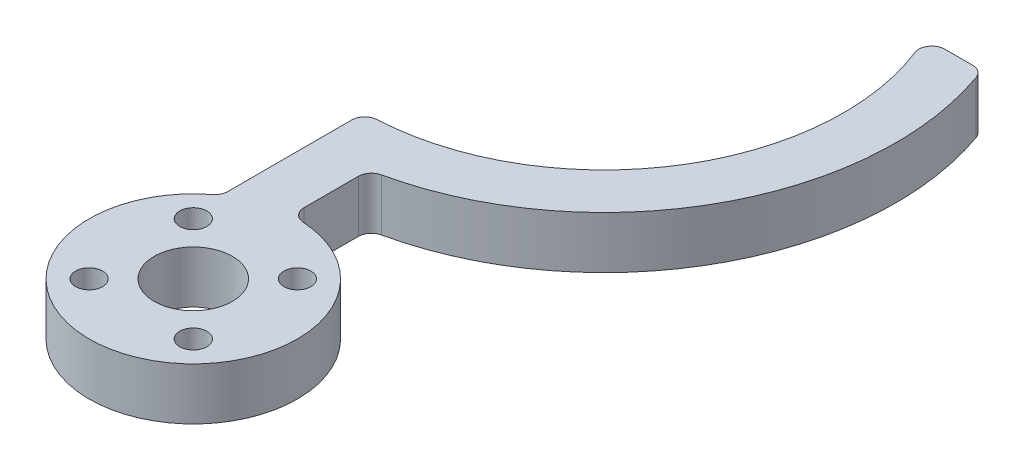
from build123d import *

# Parameters (mm, degrees)
SKETCH1_R           = 2.075
SKETCH1_R_2         = 6.003208263
BOSS_EXTRUDE2_DEPTH = 8
FILLET1_R           = 2
CUT_EXTRUDE1_DEPTH  = 19
FILLET2_R           = 2


with BuildPart() as part:
    # Sketch1 → Boss-Extrude2 (new body)
    with BuildSketch(Plane(origin=(0, 0, 0), x_dir=(1, 0, 0), z_dir=(0, 1, 0))):
        with BuildLine():
            Line((0, 44.83), (0, 36.83))
            ThreePointArc((0, 36.83), (36.83, 0), (0, -36.83))
            Line((0, -36.83), (0, -46.83))
            Line((0, -46.83), (0, -58.83))
            ThreePointArc((0, -58.83), (14.116701064, -87.229775601), (8, -56.110417137))
            Line((8, -56.110417137), (8, -44.110417137))
            ThreePointArc((8, -44.110417137), (44.649741882, 4.016148637), (0, 44.83))
        make_face()
        with Locations(Location((0.96696537, -64.081170969, 0), (0, 0, 270))):
            Circle(SKETCH1_R, mode=Mode.SUBTRACT)
        with Locations(Location((16.96696537, -64.081170969, 0), (0, 0, 270))):
            Circle(SKETCH1_R, mode=Mode.SUBTRACT)
        with Locations(Location((16.96696537, -80.081170969, 0), (0, 0, 270))):
            Circle(SKETCH1_R, mode=Mode.SUBTRACT)
        with Locations(Location((0.96696537, -80.081170969, 0), (0, 0, 270))):
            Circle(SKETCH1_R, mode=Mode.SUBTRACT)
        with Locations(Location((8.96696537, -72.081170969, 0), (0, 0, 270))):
            Circle(SKETCH1_R_2, mode=Mode.SUBTRACT)
    extrude(amount=BOSS_EXTRUDE2_DEPTH)

    # Fillet1
    fillet1_edges = [part.edges().sort_by_distance(p)[0] for p in [
        (0, 4, 58.83),
        (0, 4, 36.83),
        (0, 4, -36.83),
        (0, 4, -44.83),
        (8, 4, 44.110417137),
        (8, 4, 56.110417137),
    ]]
    fillet(fillet1_edges, radius=FILLET1_R)

    # Sketch2 → Cut-Extrude1 (cut)
    with BuildSketch(Plane(origin=(0, 8, 0), x_dir=(1, 0, 0), z_dir=(0, 1, 0))):
        with BuildLine():
            Line((41.799027506, 16.204018007), (33.073837099, 16.204018007))
            ThreePointArc((33.073837099, 16.204018007), (20.287775905, 30.738494576), (1.896986866, 36.781113915))
            ThreePointArc((1.896986866, 36.781113915), (0.549823068, 37.401147764), (0, 38.778459227))
            Line((0, 38.778459227), (0, 42.783278276))
            Line((0, 42.783278276), (0, 44.783278276))
            Line((0, 44.783278276), (-0.257809332, 46.655742188))
            Line((-0.257809332, 46.655742188), (2.752058537, 46.655742188))
            Line((2.752058537, 46.655742188), (2.752058537, 44.782949944))
            ThreePointArc((2.752058537, 44.782949944), (26.871190964, 36.772449298), (41.799027506, 16.204018007))
        make_face()
    extrude(amount=-CUT_EXTRUDE1_DEPTH, mode=Mode.SUBTRACT)

    # Fillet2
    fillet2_edges = [part.edges().sort_by_distance(p)[0] for p in [
        (41.799027506, 4, -16.204018007),
        (33.073837099, 4, -16.204018007),
    ]]
    fillet(fillet2_edges, radius=FILLET2_R)


solid = part.part
